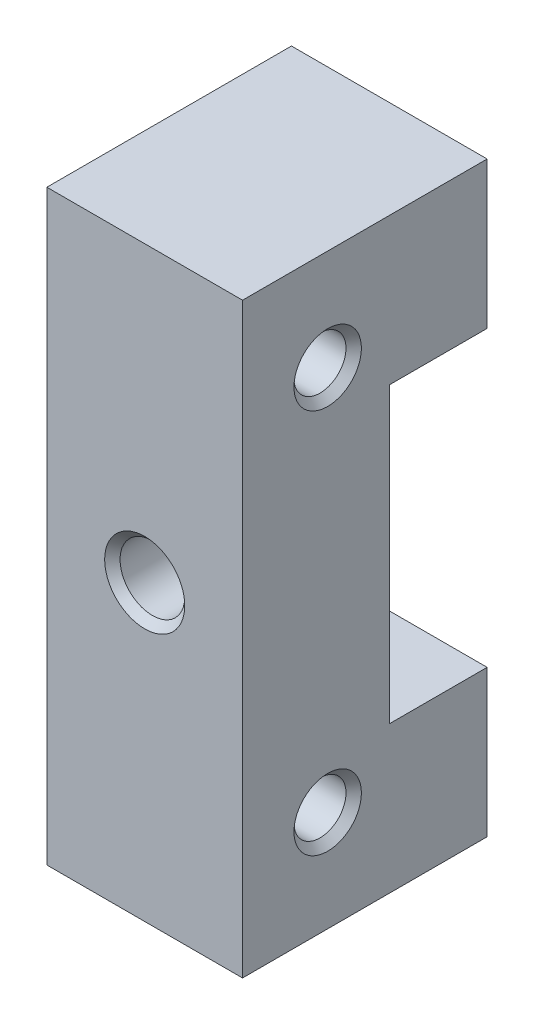
from build123d import *

# Parameters (mm, degrees)
BOSS_EXTRUDE1_DEPTH     = 12.7
F_1_4_CLEARANCE_HOLE1_D = 6.7564
M8_CLEARANCE_HOLE1_D    = 8.4
CHAMFER1_SIZE           = 1


with BuildPart() as part:
    # Sketch1 → Boss-Extrude1 (new, symmetric)
    with BuildSketch(Plane(origin=(0, 0, 0), x_dir=(0, 0, -1), z_dir=(1, 0, 0))):
        Polygon((-44.45, 241.3), (-12.7, 241.3), (-12.7, 260.35), (-25.4, 260.35), (-25.4, 298.45), (-12.7, 298.45), (-12.7, 317.5), (-44.45, 317.5), align=None)
    extrude(amount=BOSS_EXTRUDE1_DEPTH, both=True)

    # 1/4 Clearance Hole1 (through all)
    with Locations(Plane(origin=(12.7, 0, 0), x_dir=(0, 0, -1), z_dir=(1, 0, 0))):
        with Locations((-33.4, 304.4), (-33.4, 254.4)):
            Hole(F_1_4_CLEARANCE_HOLE1_D / 2)

    # M8 Clearance Hole1 (through all)
    with Locations(Plane(origin=(0, 0, 25.4), x_dir=(-1, 0, 0), z_dir=(0, 0, -1))):
        with Locations((0, 279.4)):
            Hole(M8_CLEARANCE_HOLE1_D / 2)

    # Chamfer1
    chamfer1_edges = [part.edges().sort_by_distance(p)[0] for p in [
        (12.7, 254.4, 30.0218),
        (-12.7, 254.4, 30.0218),
        (12.7, 304.4, 30.0218),
        (-12.7, 304.4, 30.0218),
        (-4.2, 279.4, 25.4),
        (-4.2, 279.4, 44.45),
    ]]
    chamfer(chamfer1_edges, length=CHAMFER1_SIZE)


solid = part.part
